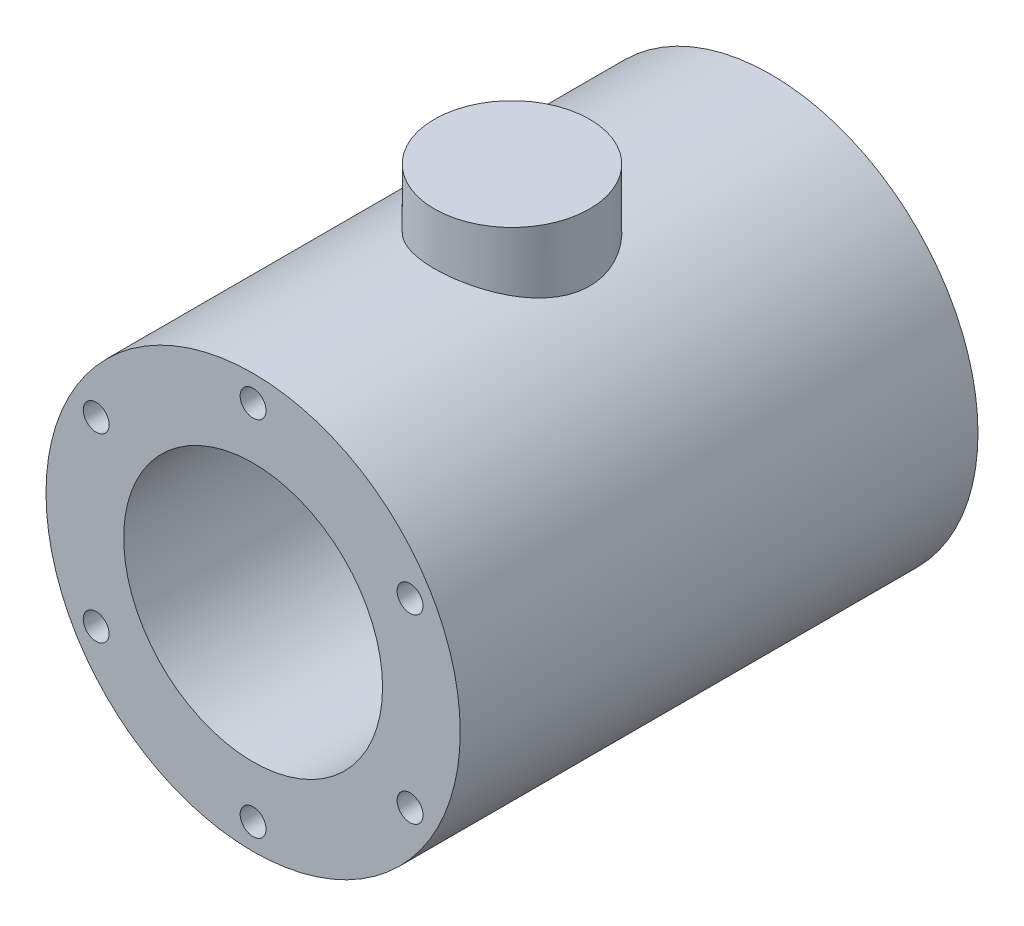
from build123d import *

# Parameters (mm, degrees)
SKETCH1_R              = 40
BODY_DEPTH             = 100
SKETCH3_R              = 25
MOTOR_CASING_DEPTH     = 246
SKETCH4_R              = 30
SLEW_BEARING_LIP_DEPTH = 7.5
BASE_START             = 30
SKETCH6_R              = 15
BASE_DEPTH             = 20
SKETCH5_R              = 2.5
SCREW_HOLES_DEPTH      = 119.74342103


with BuildPart() as part:
    # Sketch1 → body (new body)
    with BuildSketch(Plane.XY):
        Circle(SKETCH1_R)
    extrude(amount=BODY_DEPTH)

    # Sketch3 → motor casing (cut)
    with BuildSketch(Plane.XY):
        Circle(SKETCH3_R)
    extrude(amount=MOTOR_CASING_DEPTH, mode=Mode.SUBTRACT)

    # Sketch4 → slew bearing lip (cut)
    with BuildSketch(Plane.XY):
        Circle(SKETCH4_R)
    extrude(amount=SLEW_BEARING_LIP_DEPTH, mode=Mode.SUBTRACT)

    # Sketch6 → base (add)
    with BuildSketch(Plane(origin=(0, 0, 0), x_dir=(1, 0, 0), z_dir=(0, 1, 0)).offset(BASE_START)):
        with Locations(Location((0, -50, 0), (0, 0, 90))):
            Circle(SKETCH6_R)
    extrude(amount=BASE_DEPTH)

    # Sketch5 → screw holes (cut, through all)
    with BuildSketch(Plane(origin=(0, 0, 0), x_dir=(-1, 0, 0), z_dir=(0, 0, -1))):
        with Locations((0, 35)):
            Circle(SKETCH5_R)
        with Locations((30.310889132, 17.5)):
            Circle(SKETCH5_R)
        with Locations((30.310889132, -17.5)):
            Circle(SKETCH5_R)
        with Locations((0, -35)):
            Circle(SKETCH5_R)
        with Locations((-30.310889132, -17.5)):
            Circle(SKETCH5_R)
        with Locations((-30.310889132, 17.5)):
            Circle(SKETCH5_R)
    extrude(amount=-SCREW_HOLES_DEPTH, mode=Mode.SUBTRACT)


solid = part.part
